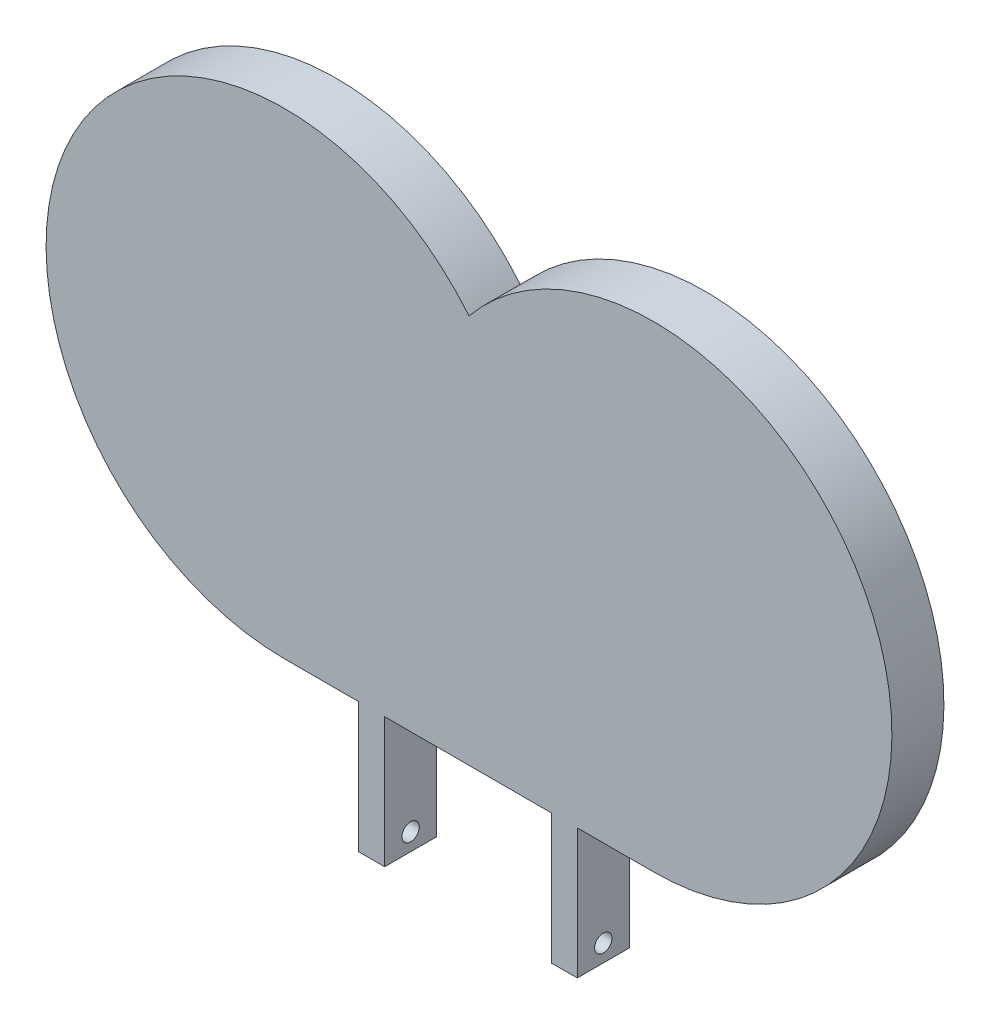
from build123d import *

# Parameters (mm, degrees)
Y_KSEKLIK_EKSTR_ZYON1_DEPTH = 12
KES_EKSTR_ZYON1_DEPTH       = 10
KES_EKSTR_ZYON4_DEPTH       = 20
IZIM4_W                     = 6
IZIM4_H                     = 12
Y_KSEKLIK_EKSTR_ZYON2_DEPTH = 30
IZIM5_R                     = 2
KES_EKSTR_ZYON5_DEPTH       = 60


with BuildPart() as part:
    # Çizim1 → Yükseklik-Ekstrüzyon1 (new body)
    with BuildSketch(Plane.XY):
        with BuildLine():
            Line((-2.88077248, -55), (82.297274127, -55))
            ThreePointArc((82.297274127, -55), (131.991875204, 23.567915135), (39.708250823, 34.801940953))
            ThreePointArc((39.708250823, 34.801940953), (-52.575373557, 23.567915135), (-2.88077248, -55))
        make_face()
    extrude(amount=Y_KSEKLIK_EKSTR_ZYON1_DEPTH)

    # Çizim2 → Kes-Ekstrüzyon1 (cut, symmetric)
    with BuildSketch(Plane.XY):
        with BuildLine():
            Line((82.297274127, -53.5), (-2.88077248, -53.5))
            ThreePointArc((-2.88077248, -53.5), (-50.81065631, 23.769228763), (39.708250823, 32.379393047))
            ThreePointArc((39.708250823, 32.379393047), (130.227157957, 23.769228763), (82.297274127, -53.5))
        make_face()
    extrude(amount=KES_EKSTR_ZYON1_DEPTH, both=True, mode=Mode.SUBTRACT)

    # Çizim3 → Kes-Ekstrüzyon4 (cut)
    with BuildSketch(Plane.XZ.offset(55)):
        with BuildLine():
            Line((25.295548254, 4.99642351), (25.295548254, 0))
            Line((25.295548254, 0), (33.431042786, 0))
            Line((33.431042786, 0), (33.431042786, 4.99642351))
            ThreePointArc((33.431042786, 4.99642351), (29.36329552, 9.064170776), (25.295548254, 4.99642351))
        make_face()
        with BuildLine():
            Line((35.422473694, 4.99642351), (35.422473694, 0))
            Line((35.422473694, 0), (43.422473694, 0))
            Line((43.422473694, 0), (43.422473694, 4.99642351))
            ThreePointArc((43.422473694, 4.99642351), (39.422473694, 8.99642351), (35.422473694, 4.99642351))
        make_face()
        with BuildLine():
            Line((45.619413975, 4.99642351), (45.619413975, 0))
            Line((45.619413975, 0), (53.887629124, 0))
            Line((53.887629124, 0), (53.887629124, 4.99642351))
            ThreePointArc((53.887629124, 4.99642351), (49.753521549, 9.130531084), (45.619413975, 4.99642351))
        make_face()
    extrude(amount=-KES_EKSTR_ZYON4_DEPTH, mode=Mode.SUBTRACT)

    # Çizim4 → Yükseklik-Ekstrüzyon2 (add)
    with BuildSketch(Plane(origin=(0, -55, 0), x_dir=(-1, 0, 0), z_dir=(0, -1, 0))):
        with Locations((-17.243778266, -6)):
            Rectangle(IZIM4_W, IZIM4_H)
        with Locations((-61.695384492, -6)):
            Rectangle(IZIM4_W, IZIM4_H)
    extrude(amount=Y_KSEKLIK_EKSTR_ZYON2_DEPTH)

    # Çizim5 → Kes-Ekstrüzyon5 (cut)
    with BuildSketch(Plane(origin=(64.695384492, 0, 0), x_dir=(0, 0, -1), z_dir=(1, 0, 0))):
        with Locations(Location((-6, -81.004647187, 0), (0, 0, 90))):
            Circle(IZIM5_R)
    extrude(amount=-KES_EKSTR_ZYON5_DEPTH, mode=Mode.SUBTRACT)


solid = part.part
